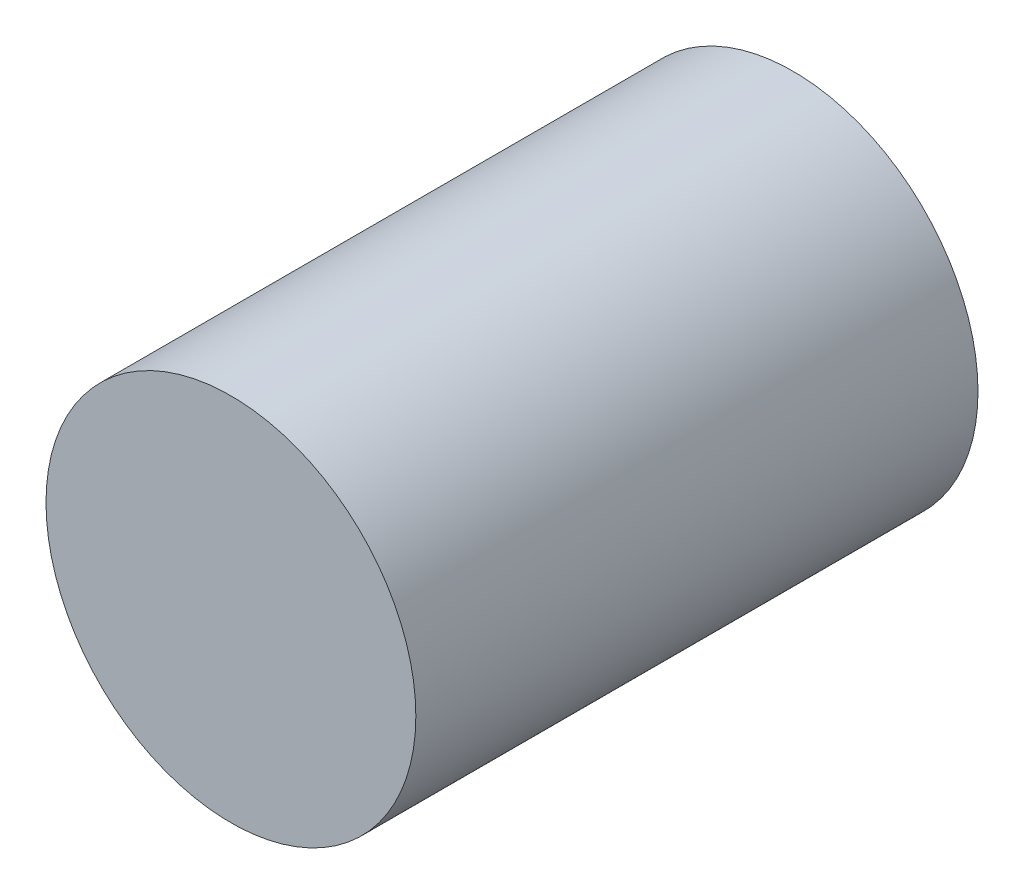
from build123d import *

# Parameters (mm, degrees)
SKETCH1_R           = 0.25
BOSS_EXTRUDE1_DEPTH = 0.76


with BuildPart() as part:
    # Sketch1 → Boss-Extrude1 (new body)
    with BuildSketch(Plane.XY):
        with Locations((-0.405742809, -16.382376909)):
            Circle(SKETCH1_R)
    extrude(amount=BOSS_EXTRUDE1_DEPTH)


solid = part.part
